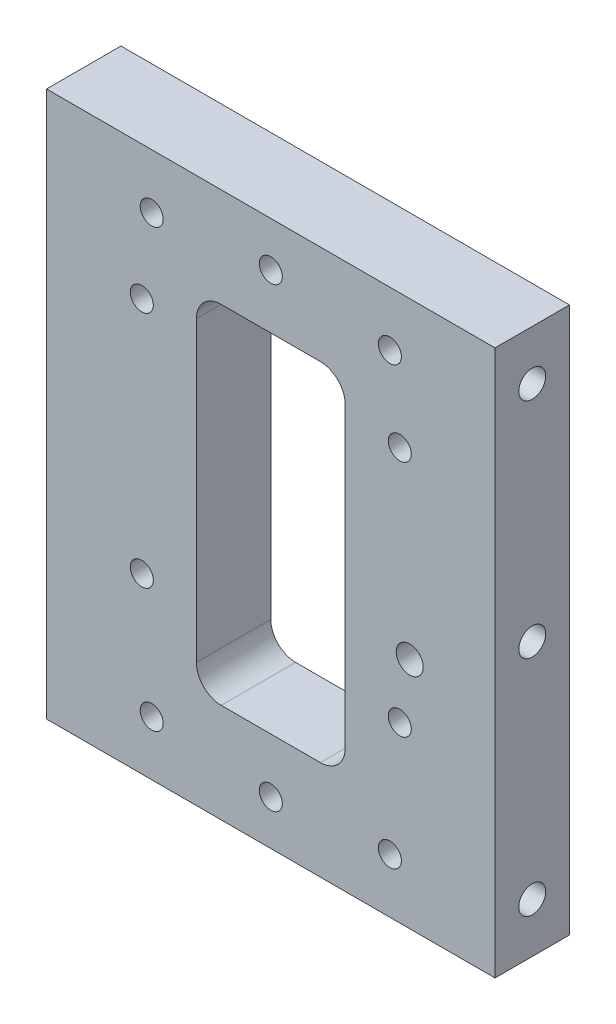
from build123d import *

# Parameters (mm, degrees)
SKETCH2_W                      = 38.1
SKETCH2_H                      = 69.85
BOSS_EXTRUDE1_DEPTH            = 4.7625
FILLET1_R                      = 6.35
F_4_CLEARANCE_HOLE1_D          = 2.9464
BOSS_EXTRUDE2_DEPTH            = 9.525
F_8_32_TAPPED_HOLE1_AT_2_COUNT = 2
F_8_32_TAPPED_HOLE1_AT_2_PITCH = 28.575
F_8_32_TAPPED_HOLE1_AT_3_COUNT = 2
F_8_32_TAPPED_HOLE1_AT_3_PITCH = 28.575
SKETCH12_W                     = 19.05
SKETCH12_H                     = 44.45
CUT_EXTRUDE1_DEPTH             = 47.198333888
FILLET2_R                      = 3.175
F_8_32_TAPPED_HOLE2_D          = 3.4544


with BuildPart() as part:
    # Sketch2 → Boss-Extrude1 (new, symmetric)
    with BuildSketch(Plane.XY):
        Rectangle(SKETCH2_W, SKETCH2_H)
    extrude(amount=BOSS_EXTRUDE1_DEPTH, both=True)

    # Fillet1
    fillet1_edges = [part.edges().sort_by_distance(p)[0] for p in [
        (19.05, -34.925, 0),
        (-19.05, -34.925, 0),
        (-19.05, 34.925, 0),
        (19.05, 34.925, 0),
    ]]
    fillet(fillet1_edges, radius=FILLET1_R)

    # #4 Clearance Hole1 (through all)
    with Locations(Plane.XY.offset(4.7625)):
        with Locations((0, 29.21), (-15.24, 27.94), (15.24, 27.94), (-15.24, -27.94), (15.24, -27.94), (-16.51, 17.78), (-16.51, -12.7), (16.51, 17.78), (16.51, -12.7), (0, -29.21)):
            Hole(F_4_CLEARANCE_HOLE1_D / 2)

    # Sketch6 → Boss-Extrude2 (add)
    with BuildSketch(Plane(origin=(0, 0, -4.7625), x_dir=(-1, 0, 0), z_dir=(0, 0, -1))):
        with BuildLine():
            Line((-28.702, -34.925), (-12.7, -34.925))
            ThreePointArc((-12.7, -34.925), (-17.190128061, -33.065128061), (-19.05, -28.575))
            Line((-19.05, -28.575), (-19.05, 28.575))
            ThreePointArc((-19.05, 28.575), (-17.190128061, 33.065128061), (-12.7, 34.925))
            Line((-12.7, 34.925), (-28.702, 34.925))
            Line((-28.702, 34.925), (-28.702, -34.925))
        make_face()
        with BuildLine():
            Line((28.702, -34.925), (28.702, 34.925))
            Line((28.702, 34.925), (12.7, 34.925))
            ThreePointArc((12.7, 34.925), (17.190128061, 33.065128061), (19.05, 28.575))
            Line((19.05, 28.575), (19.05, -28.575))
            ThreePointArc((19.05, -28.575), (17.190128061, -33.065128061), (12.7, -34.925))
            Line((12.7, -34.925), (28.702, -34.925))
        make_face()
    extrude(amount=-BOSS_EXTRUDE2_DEPTH)

    # Sketch11 → #8-32 Tapped Hole1 (revolve, cut)
    with BuildSketch(Plane(origin=(28.702, 0, 0), x_dir=(0, 0, -1), z_dir=(0, 1, 0))):
        Polygon((0, 0), (0, 10.562806461), (1.7272, 9.525), (1.7272, 0), align=None)
    f_8_32_tapped_hole1 = revolve(axis=Axis((35.052, 0, 0), (-1, 0, 0)), mode=Mode.SUBTRACT)

    # #8-32 Tapped Hole1 at 2: #8-32 Tapped Hole1 ×2
    with Locations(*[(0, i * F_8_32_TAPPED_HOLE1_AT_2_PITCH, 0) for i in range(1, F_8_32_TAPPED_HOLE1_AT_2_COUNT)]):
        add(f_8_32_tapped_hole1, mode=Mode.SUBTRACT)

    # #8-32 Tapped Hole1 at 3: #8-32 Tapped Hole1 ×2
    with Locations(*[(0, -i * F_8_32_TAPPED_HOLE1_AT_3_PITCH, 0) for i in range(1, F_8_32_TAPPED_HOLE1_AT_3_COUNT)]):
        add(f_8_32_tapped_hole1, mode=Mode.SUBTRACT)

    # Mirror1: #8-32 Tapped Hole1 across plane
    add(f_8_32_tapped_hole1.mirror(Plane(origin=(0, 0, 0), x_dir=(0, 0, 1), z_dir=(1, 0, 0))), mode=Mode.SUBTRACT)

    # Mirror1 copy 1 sketch → Mirror1 copy 1 (revolve, cut)
    with BuildSketch(Plane(origin=(-28.702, 28.575, 0), x_dir=(0, 0, -1), z_dir=(0, 1, 0))):
        Polygon((0, 0), (0, -10.562806461), (1.7272, -9.525), (1.7272, 0), align=None)
    revolve(axis=Axis((-35.052, 28.575, 0), (-1, 0, 0)), mode=Mode.SUBTRACT)

    # Mirror1 copy 2 sketch → Mirror1 copy 2 (revolve, cut)
    with BuildSketch(Plane(origin=(-28.702, -28.575, 0), x_dir=(0, 0, -1), z_dir=(0, 1, 0))):
        Polygon((0, 0), (0, -10.562806461), (1.7272, -9.525), (1.7272, 0), align=None)
    revolve(axis=Axis((-35.052, -28.575, 0), (-1, 0, 0)), mode=Mode.SUBTRACT)

    # Sketch12 → Cut-Extrude1 (cut, through all)
    with BuildSketch(Plane(origin=(0, 0, -4.7625), x_dir=(-1, 0, 0), z_dir=(0, 0, -1))):
        Rectangle(SKETCH12_W, SKETCH12_H)
    extrude(amount=-CUT_EXTRUDE1_DEPTH, mode=Mode.SUBTRACT)

    # Fillet2
    fillet2_edges = [part.edges().sort_by_distance(p)[0] for p in [
        (-9.525, 22.225, 0),
        (-9.525, -22.225, 0),
        (9.525, -22.225, 0),
        (9.525, 22.225, 0),
    ]]
    fillet(fillet2_edges, radius=FILLET2_R)

    # #8-32 Tapped Hole2 (through all)
    with Locations(Plane(origin=(0, 0, -4.7625), x_dir=(-1, 0, 0), z_dir=(0, 0, -1))):
        with Locations((-17.78, -5.08)):
            Hole(F_8_32_TAPPED_HOLE2_D / 2)


solid = part.part
